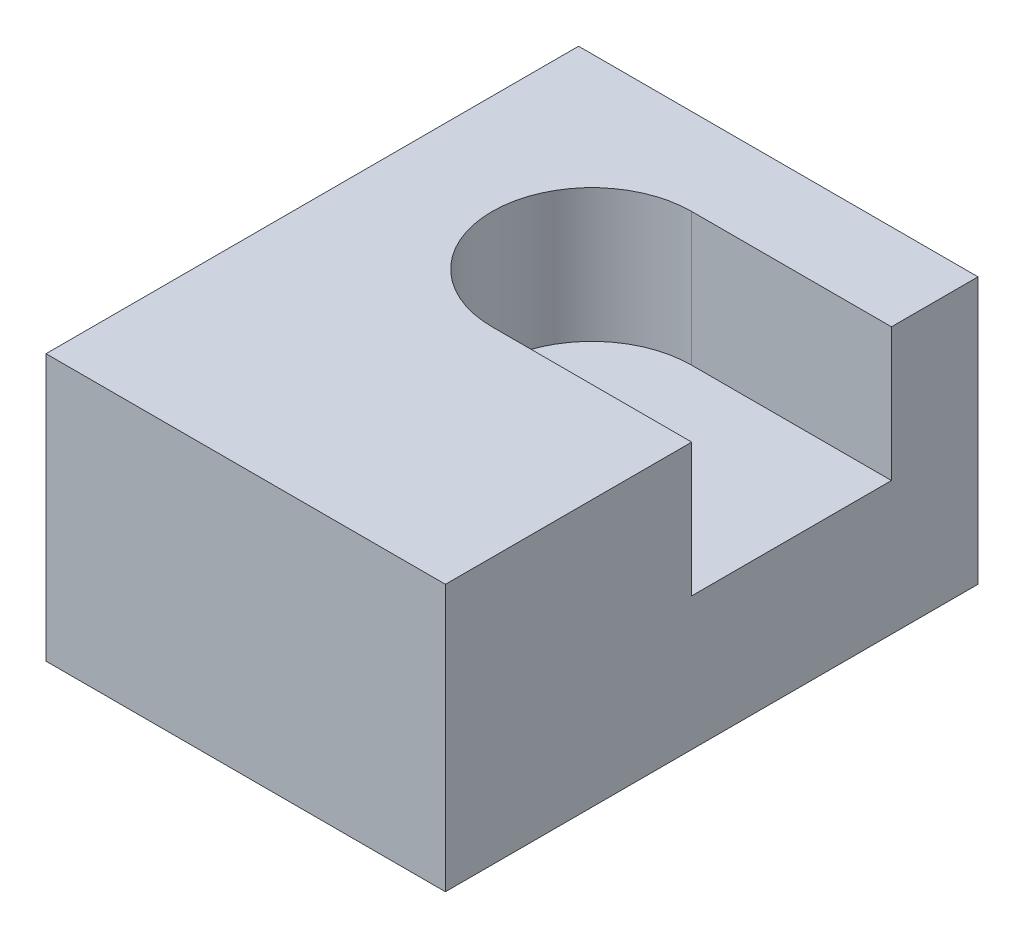
from build123d import *

# Parameters (mm, degrees)
SKETCH1_W           = 38.1
SKETCH1_H           = 25.4
BOSS_EXTRUDE1_DEPTH = 50.8
CUT_EXTRUDE1_DEPTH  = 12.7


with BuildPart() as part:
    # Sketch1 → Boss-Extrude1 (new body)
    with BuildSketch(Plane.XY):
        Rectangle(SKETCH1_W, SKETCH1_H)
    extrude(amount=BOSS_EXTRUDE1_DEPTH)

    # Sketch2 → Cut-Extrude1 (cut)
    with BuildSketch(Plane(origin=(0, 12.7, 0), x_dir=(1, 0, 0), z_dir=(0, 1, 0))):
        with BuildLine():
            Line((19.05, -8.255), (0, -8.255))
            ThreePointArc((0, -8.255), (-9.525, -17.78), (0, -27.305))
            Line((0, -27.305), (19.05, -27.305))
            Line((19.05, -27.305), (19.05, -8.255))
        make_face()
    extrude(amount=-CUT_EXTRUDE1_DEPTH, mode=Mode.SUBTRACT)


solid = part.part
